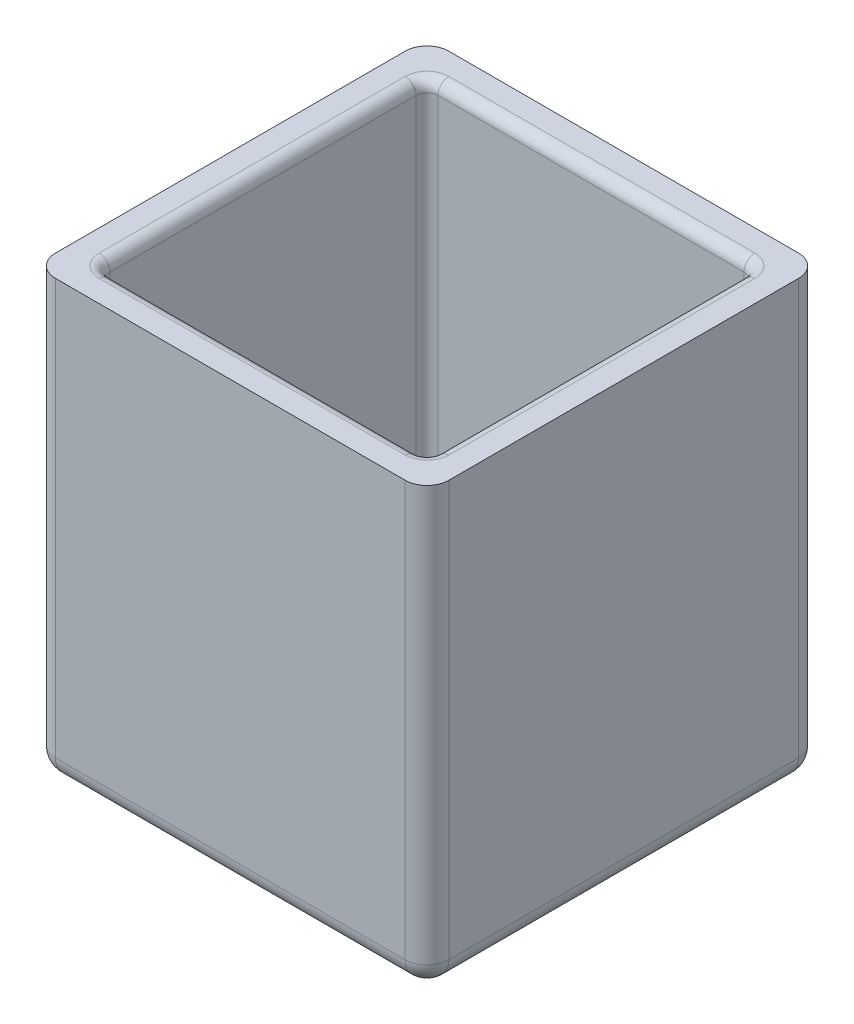
from build123d import *

# Parameters (mm, degrees)
SKETCH1_W           = 36
SKETCH1_H           = 36
SKETCH1_W_2         = 30
SKETCH1_H_2         = 30
BOSS_EXTRUDE1_DEPTH = 40
SKETCH2_W           = 30
SKETCH2_H           = 30
BOSS_EXTRUDE2_DEPTH = 3
FILLET_1_R          = 2
FILLET_2_R          = 2
FILLET_3_R          = 1


with BuildPart() as part:
    # Sketch1 → Boss-Extrude1 (new body)
    with BuildSketch(Plane(origin=(0, 0, 0), x_dir=(1, 0, 0), z_dir=(0, 1, 0))):
        with Locations((18, 18)):
            Rectangle(SKETCH1_W, SKETCH1_H)
        with Locations((18, 18)):
            Rectangle(SKETCH1_W_2, SKETCH1_H_2, mode=Mode.SUBTRACT)
    extrude(amount=BOSS_EXTRUDE1_DEPTH)

    # Sketch2 → Boss-Extrude2 (add)
    with BuildSketch(Plane.XZ):
        with Locations((18, -18)):
            Rectangle(SKETCH2_W, SKETCH2_H)
    extrude(amount=-BOSS_EXTRUDE2_DEPTH)

    # Скругление1
    fillet_1_edges = [part.edges().sort_by_distance(p)[0] for p in [
        (0, 20, -36),
        (36, 20, -36),
        (36, 20, 0),
        (0, 20, 0),
    ]]
    fillet(fillet_1_edges, radius=FILLET_1_R)

    # Скругление2
    fillet_2_edges = [part.edges().sort_by_distance(p)[0] for p in [
        (0, 0, -18),
        (18, 0, -36),
        (36, 0, -18),
        (18, 0, 0),
        (35.414213562, 0, -0.585786438),
        (35.414213562, 0, -35.414213562),
        (0.585786438, 0, -0.585786438),
        (0.585786438, 0, -35.414213562),
    ]]
    fillet(fillet_2_edges, radius=FILLET_2_R)

    # Скругление3
    fillet_3_edges = [part.edges().sort_by_distance(p)[0] for p in [
        (3, 21.5, -33),
        (3, 21.5, -3),
        (33, 21.5, -3),
        (33, 21.5, -33),
        (3, 40, -18),
        (18, 40, -3),
        (33, 40, -18),
        (18, 40, -33),
        (18, 3, -33),
        (3, 3, -18),
        (18, 3, -3),
        (33, 3, -18),
    ]]
    fillet(fillet_3_edges, radius=FILLET_3_R)


solid = part.part
